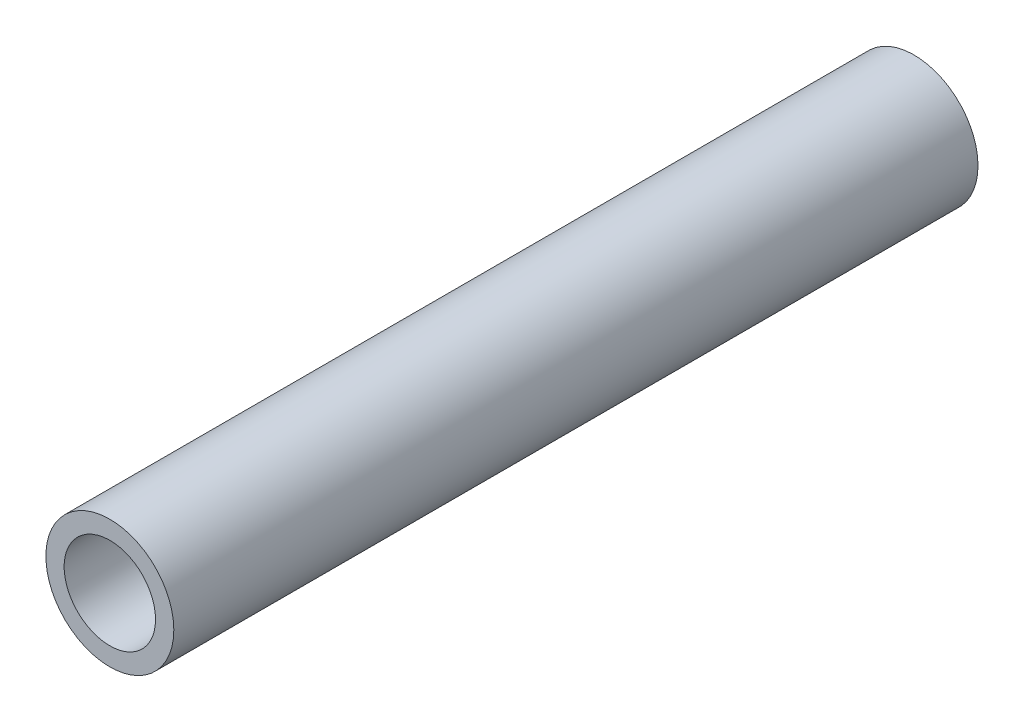
from build123d import *

# Parameters (mm, degrees)
SKETCH1_R           = 11.1125
SKETCH1_R_2         = 7.9375
BOSS_EXTRUDE1_DEPTH = 139.7


with BuildPart() as part:
    # Sketch1 → Boss-Extrude1 (new body)
    with BuildSketch(Plane.XY):
        Circle(SKETCH1_R)
        Circle(SKETCH1_R_2, mode=Mode.SUBTRACT)
    extrude(amount=-BOSS_EXTRUDE1_DEPTH)


solid = part.part
